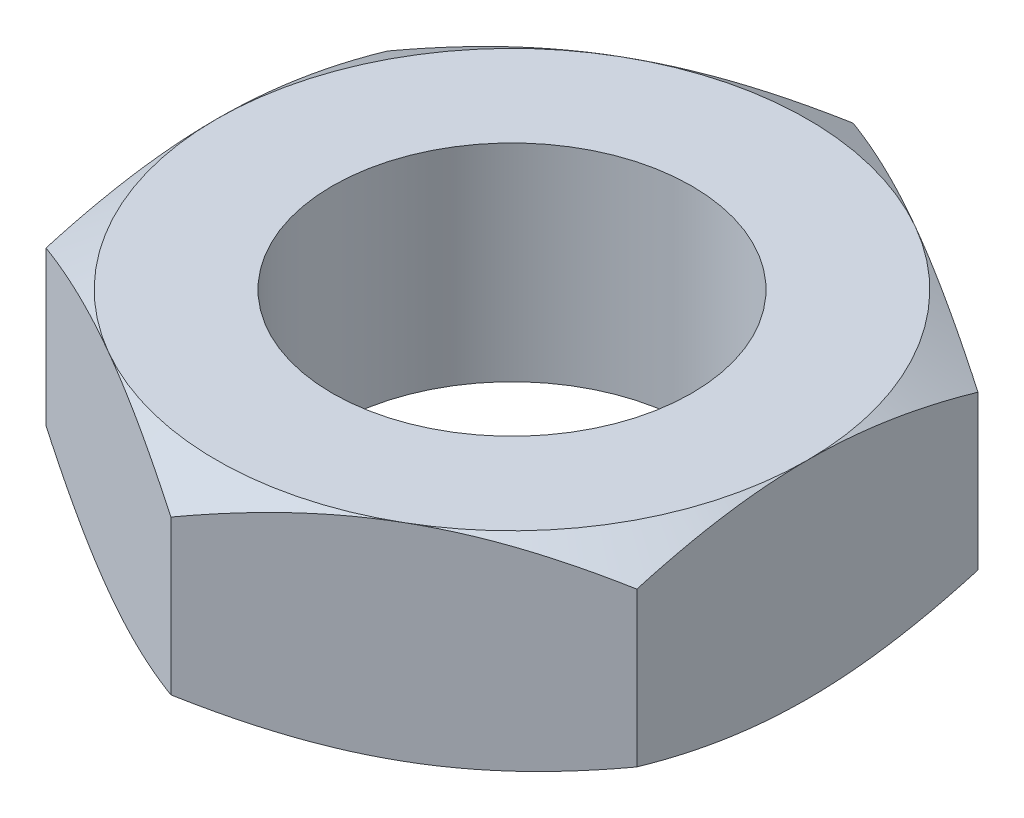
from build123d import *

# Parameters (mm, degrees)
SKETCH1_R               = 2.413
BOSS_EXTRUDE1_DEPTH     = 1.3890625
SKETCH5_OUTSIDE_W       = 38.99
SKETCH5_OUTSIDE_H       = 40.218
SKETCH5_OUTSIDE_R       = 3.96875
CUT_EXTRUDE2_DEPTH      = 7.668602339
CUT_EXTRUDE2_DRAFT      = -60
MIRROR1_COPY_1_SKETCH_W = 38.99
MIRROR1_COPY_1_SKETCH_H = 40.218
MIRROR1_COPY_1_SKETCH_R = 3.96875
MIRROR1_COPY_1_DEPTH    = 7.668602339
MIRROR1_COPY_1_DRAFT    = -60


with BuildPart() as part:
    # Sketch1 → Boss-Extrude1 (new, symmetric)
    with BuildSketch(Plane(origin=(0, 0, 0), x_dir=(1, 0, 0), z_dir=(0, 1, 0))):
        Polygon((-3.96875, 2.291358881), (-3.96875, -2.291358881), (0, -4.582717762), (3.96875, -2.291358881), (3.96875, 2.291358881), (0, 4.582717762), align=None)
        Circle(SKETCH1_R, mode=Mode.SUBTRACT)
    extrude(amount=BOSS_EXTRUDE1_DEPTH, both=True)


with BuildPart() as cut_extrude2_tool:
    # Sketch5 outside → Cut-Extrude2 (with draft: the straight prism first)
    with BuildSketch(Plane(origin=(0, 1.3890625, 0), x_dir=(1, 0, 0), z_dir=(0, 1, 0))):
        Rectangle(SKETCH5_OUTSIDE_W, SKETCH5_OUTSIDE_H)
        Circle(SKETCH5_OUTSIDE_R, mode=Mode.SUBTRACT)
    extrude(amount=-CUT_EXTRUDE2_DEPTH)
    # Cut-Extrude2: the draft: its side faces are tilted about the plane it starts from
    cut_extrude2_sides = [cut_extrude2_tool.faces().sort_by_distance(p)[0] for p in [
        (0, -2.44523867, 20.109),
        (19.495, -2.44523867, 0),
        (0, -2.44523867, -20.109),
        (-19.495, -2.44523867, 0),
        (-3.96875, -2.44523867, 0),
    ]]
    draft(cut_extrude2_sides, Plane(origin=(0, 1.3890625, 0), x_dir=(1, 0, 0), z_dir=(0, 1, 0)), CUT_EXTRUDE2_DRAFT)


with BuildPart() as part_1:
    add(part.part)

    # Cut-Extrude2: cut by cut_extrude2_tool
    add(cut_extrude2_tool.part, mode=Mode.SUBTRACT)


with BuildPart() as mirror1_copy_1_tool:
    # Mirror1 copy 1 sketch → Mirror1 copy 1 (with draft: the straight prism first)
    with BuildSketch(Plane.XZ.offset(1.3890625)):
        Rectangle(MIRROR1_COPY_1_SKETCH_W, MIRROR1_COPY_1_SKETCH_H)
        Circle(MIRROR1_COPY_1_SKETCH_R, mode=Mode.SUBTRACT)
    extrude(amount=-MIRROR1_COPY_1_DEPTH)
    # Mirror1 copy 1: the draft: its side faces are tilted about the plane it starts from
    mirror1_copy_1_sides = [mirror1_copy_1_tool.faces().sort_by_distance(p)[0] for p in [
        (0, 2.44523867, 20.109),
        (19.495, 2.44523867, 0),
        (0, 2.44523867, -20.109),
        (-19.495, 2.44523867, 0),
        (-3.96875, 2.44523867, 0),
    ]]
    draft(mirror1_copy_1_sides, Plane.XZ.offset(1.3890625), MIRROR1_COPY_1_DRAFT)


with BuildPart() as part_2:
    add(part_1.part)

    # Mirror1 copy 1: cut by mirror1_copy_1_tool
    add(mirror1_copy_1_tool.part, mode=Mode.SUBTRACT)


solid = part_2.part
